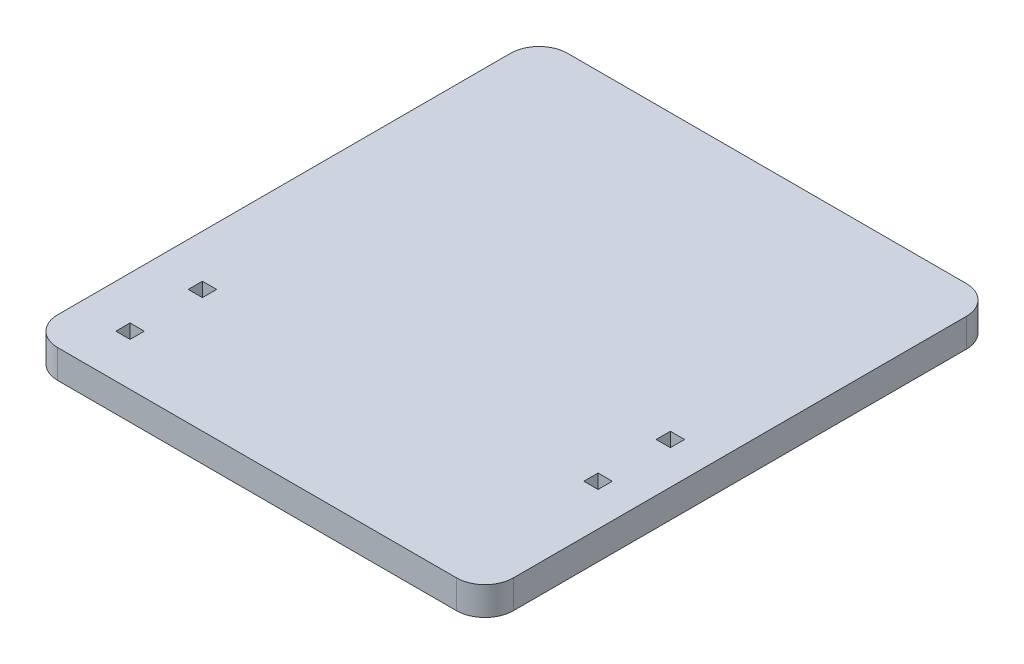
from build123d import *

# Parameters (mm, degrees)
SKETCH1_W           = 0.5
SKETCH1_H           = 0.5
BOSS_EXTRUDE1_DEPTH = 1


with BuildPart() as part:
    # Sketch1 → Boss-Extrude1 (new body)
    with BuildSketch(Plane(origin=(0, 0, 0), x_dir=(1, 0, 0), z_dir=(0, 1, 0))):
        with BuildLine():
            Line((1, 0), (15, 0))
            ThreePointArc((15, 0), (15.707106781, 0.292893219), (16, 1))
            Line((16, 1), (16, 16.9))
            ThreePointArc((16, 16.9), (15.707106781, 17.607106781), (15, 17.9))
            Line((15, 17.9), (1, 17.9))
            ThreePointArc((1, 17.9), (0.292893219, 17.607106781), (0, 16.9))
            Line((0, 16.9), (0, 1))
            ThreePointArc((0, 1), (0.292893219, 0.292893219), (1, 0))
        make_face()
        with Locations((1.77, 1.77)):
            Rectangle(SKETCH1_W, SKETCH1_H, mode=Mode.SUBTRACT)
        with Locations((1.77, 4.31)):
            Rectangle(SKETCH1_W, SKETCH1_H, mode=Mode.SUBTRACT)
        with Locations((14.548, 7.963)):
            Rectangle(SKETCH1_W, SKETCH1_H, mode=Mode.SUBTRACT)
        with Locations((14.548, 5.423)):
            Rectangle(SKETCH1_W, SKETCH1_H, mode=Mode.SUBTRACT)
    extrude(amount=BOSS_EXTRUDE1_DEPTH)


solid = part.part
